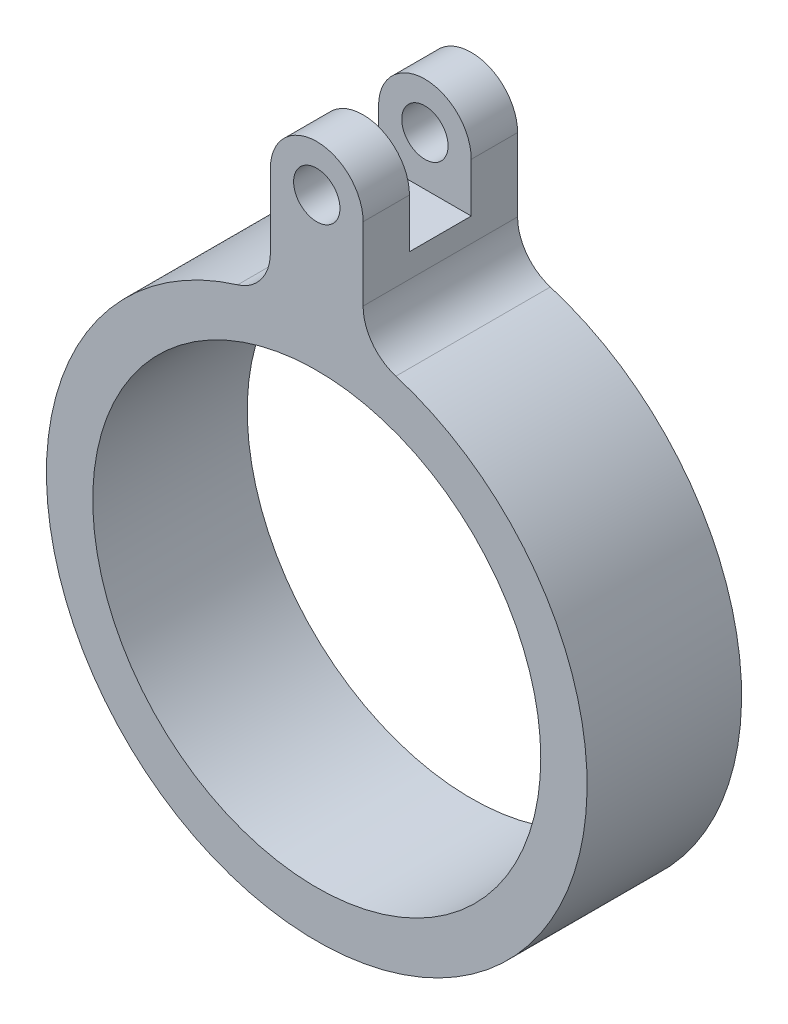
from build123d import *

# Parameters (mm, degrees)
SKETCH1_R           = 17.5
SKETCH1_R_2         = 14.5
BOSS_EXTRUDE1_DEPTH = 10
BOSS_EXTRUDE2_DEPTH = 10
SKETCH5_R           = 3
BOSS_EXTRUDE3_DEPTH = 10
FILLET1_R           = 3
SKETCH6_R           = 1.5
CUT_EXTRUDE1_DEPTH  = 10
CUT_EXTRUDE2_DEPTH  = 4


with BuildPart() as part:
    # Sketch1 → Boss-Extrude1 (new body)
    with BuildSketch(Plane.XY):
        Circle(SKETCH1_R)
        Circle(SKETCH1_R_2, mode=Mode.SUBTRACT)
    extrude(amount=BOSS_EXTRUDE1_DEPTH)

    # Sketch4 → Boss-Extrude2 (add)
    with BuildSketch(Plane.XY.offset(10)):
        Polygon((-3, 19.250821316), (-3, 16.430441273), (3, 16.430441273), (3, 19.250821316), (3, 24.327875781), (-3, 24.327875781), align=None)
    extrude(amount=-BOSS_EXTRUDE2_DEPTH)

    # Sketch5 → Boss-Extrude3 (add)
    with BuildSketch(Plane.XY.offset(10)):
        with Locations((0, 24.327875781)):
            Circle(SKETCH5_R)
    extrude(amount=-BOSS_EXTRUDE3_DEPTH)

    # Fillet1
    fillet1_edges = [part.edges().sort_by_distance(p)[0] for p in [
        (3, 17.24093965, 5),
        (-3, 17.24093965, 5),
    ]]
    fillet(fillet1_edges, radius=FILLET1_R)

    # Sketch6 → Cut-Extrude1 (cut)
    with BuildSketch(Plane.XY.offset(10)):
        with Locations((0, 24.327875781)):
            Circle(SKETCH6_R)
    extrude(amount=-CUT_EXTRUDE1_DEPTH, mode=Mode.SUBTRACT)

    # Sketch7 → Cut-Extrude2 (cut)
    with BuildSketch(Plane.XY.offset(7)):
        Polygon((-6, 21.148402448), (3.429094676, 21.148402448), (5.067314065, 21.148402448), (5.31985813, 21.327875781), (5.31985813, 28.263680706), (-6, 28.263680706), align=None)
    extrude(amount=-CUT_EXTRUDE2_DEPTH, mode=Mode.SUBTRACT)


solid = part.part
